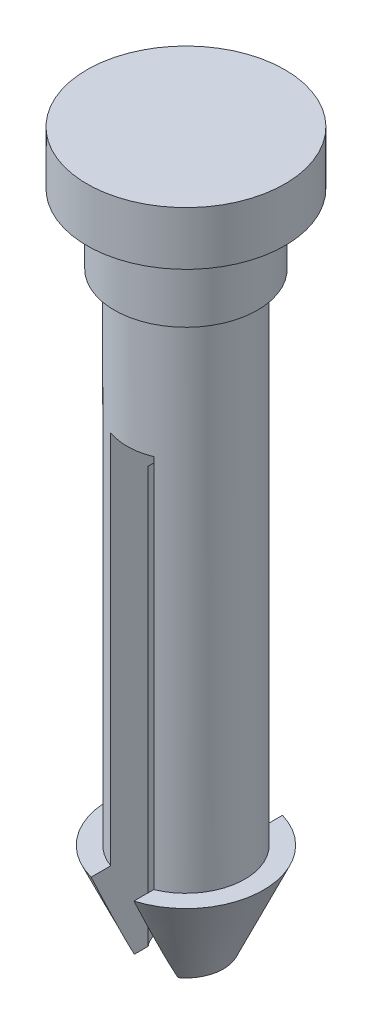
from build123d import *

# Parameters (mm, degrees)
CUT_EXTRUDE1_DEPTH      = 18.194103655
CUT_EXTRUDE1_DEPTH_BACK = 18.194103655
SKETCH3_W               = 1
SKETCH3_H               = 11


with BuildPart() as part:
    # Sketch1 → Revolve1 (revolve)
    with BuildSketch(Plane.XY, mode=Mode.PRIVATE) as revolve1_sk:
        Polygon((0, -7), (0, 0), (2.3495, 0), (2.3495, -1.27), (1.7, -1.27), (1.7, -2.92), (1.397, -2.92), (1.397, -14.77), (1.8415, -14.77), (0.889, -16.87), (0.635, -16.87), (0.635, -7), align=None)
    revolve(revolve1_sk.sketch.rotate(Axis((0, -7, 0), (0, 1, 0)), 90), axis=Axis((0, -7, 0), (0, 1, 0)))

    # Sketch3 → Cut-Extrude1 (cut, two sides: drawn at the far end of the back side and taken through both)
    with BuildSketch(Plane.XY.offset(-CUT_EXTRUDE1_DEPTH_BACK)):
        with Locations((0.029190269, -11.37)):
            Rectangle(SKETCH3_W, SKETCH3_H)
    extrude(amount=CUT_EXTRUDE1_DEPTH + CUT_EXTRUDE1_DEPTH_BACK, mode=Mode.SUBTRACT)


solid = part.part
